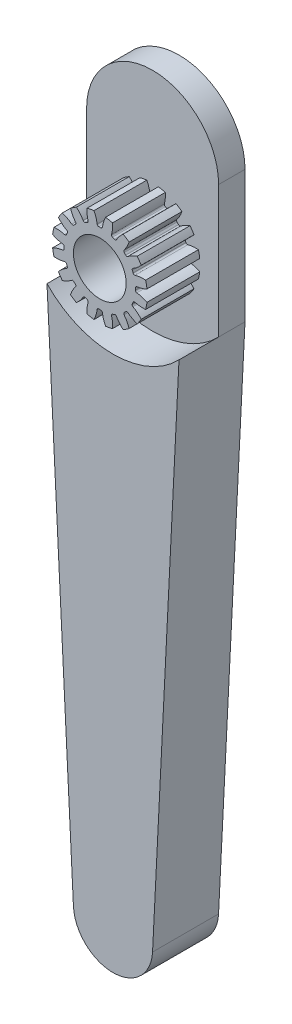
from build123d import *

# Parameters (mm, degrees)
SKETCH1_R                = 15
BOSS_EXTRUDE1_DEPTH      = 10
SKETCH2_R                = 18
BOSS_EXTRUDE2_DEPTH      = 20
CUT_EXTRUDE3_START       = -20
CUT_EXTRUDE3_DEPTH       = 20
FILLET1_R                = 0.6
CIRPATTERN1_COUNT        = 16
FILLET1_OF_CIRPATTERN1_R = 0.6
BOSS_EXTRUDE5_DEPTH      = 15
BOSS_EXTRUDE6_DEPTH      = 10
CUT_EXTRUDE4_DEPTH       = 270.867002732
CUT_EXTRUDE4_DEPTH_BACK  = 270.867002732
SKETCH10_R               = 10


with BuildPart() as part:
    # Sketch1 → Boss-Extrude1 (new body)
    with BuildSketch(Plane.XY):
        with BuildLine():
            Line((0, -50), (0, 0))
            Line((0, 0), (-50, 0))
            Line((-50, 0), (-50, -50))
            Line((-50, -50), (-39.981072052, -249.245626077))
            ThreePointArc((-39.981072052, -249.245626077), (-25.376775281, -233.497046006), (-10, -248.492313272))
            ThreePointArc((-10, -248.492313272), (-10.004732734, -248.869088553), (-10.018927948, -249.245626077))
            Line((-10.018927948, -249.245626077), (0, -50))
        make_face()
        with Locations((-25, -248.492313272)):
            Circle(SKETCH1_R)
    extrude(amount=BOSS_EXTRUDE1_DEPTH)

    # Sketch2 → Boss-Extrude2 (add)
    with BuildSketch(Plane.XY.offset(10)):
        with Locations((-25, -30)):
            Circle(SKETCH2_R)
    extrude(amount=BOSS_EXTRUDE2_DEPTH)

    # Sketch6 → Cut-Extrude3 (cut)
    with BuildSketch(Plane.XY.offset(30).offset(CUT_EXTRUDE3_START)):
        with BuildLine():
            ThreePointArc((-27.183976529, -12.132984398), (-26.344989379, -14.270839421), (-25.952519292, -16.533645371))
            ThreePointArc((-25.952519292, -16.533645371), (-25, -16.5), (-24.047480708, -16.533645371))
            ThreePointArc((-24.047480708, -16.533645371), (-23.655010621, -14.270839421), (-22.816023471, -12.132984398))
            ThreePointArc((-22.816023471, -12.132984398), (-25, -12), (-27.183976529, -12.132984398))
        make_face()
    cut_extrude3 = extrude(amount=CUT_EXTRUDE3_DEPTH, mode=Mode.SUBTRACT)

    # Fillet1
    fillet1_edges = [part.edges().sort_by_distance(p)[0] for p in [
        (-24.047480708, -16.533645371, 20),
        (-25.952519292, -16.533645371, 20),
    ]]
    fillet(fillet1_edges, radius=FILLET1_R)

    # CirPattern1: Cut-Extrude3 ×16 about axis
    cirpattern1_axis = Axis((-25, -30, 0), (0, 0, 1))
    for i in range(1, CIRPATTERN1_COUNT):
        add(cut_extrude3.rotate(cirpattern1_axis, i * 360 / CIRPATTERN1_COUNT), mode=Mode.SUBTRACT)

    # Fillet1 of CirPattern1
    fillet1_of_cirpattern1_edges = [part.edges().sort_by_distance(p)[0] for p in [
        (-29.273337733, -17.194197229, 20),
        (-31.033363889, -17.923223932, 20),
        (-33.848617826, -19.804316474, 20),
        (-35.195683526, -21.151382174, 20),
        (-37.076776068, -23.966636111, 20),
        (-37.805802771, -25.726662267, 20),
        (-38.466354629, -29.047480708, 20),
        (-38.466354629, -30.952519292, 20),
        (-37.805802771, -34.273337733, 20),
        (-37.076776068, -36.033363889, 20),
        (-35.195683526, -38.848617826, 20),
        (-33.848617826, -40.195683526, 20),
        (-31.033363889, -42.076776068, 20),
        (-29.273337733, -42.805802771, 20),
        (-25.952519292, -43.466354629, 20),
        (-24.047480708, -43.466354629, 20),
        (-20.726662267, -42.805802771, 20),
        (-18.966636111, -42.076776068, 20),
        (-16.151382174, -40.195683526, 20),
        (-14.804316474, -38.848617826, 20),
        (-12.923223932, -36.033363889, 20),
        (-12.194197229, -34.273337733, 20),
        (-11.533645371, -30.952519292, 20),
        (-11.533645371, -29.047480708, 20),
        (-12.194197229, -25.726662267, 20),
        (-12.923223932, -23.966636111, 20),
        (-14.804316474, -21.151382174, 20),
        (-16.151382174, -19.804316474, 20),
        (-18.966636111, -17.923223932, 20),
        (-20.726662267, -17.194197229, 20),
    ]]
    fillet(fillet1_of_cirpattern1_edges, radius=FILLET1_OF_CIRPATTERN1_R)

    # Sketch8 → Boss-Extrude5 (add)
    with BuildSketch(Plane.XY.offset(10)):
        with BuildLine():
            Line((-50, -50), (-39.981072052, -249.245626077))
            ThreePointArc((-39.981072052, -249.245626077), (-25, -263.492313272), (-10.018927948, -249.245626077))
            Line((-10.018927948, -249.245626077), (0, -50))
            ThreePointArc((0, -50), (-25, -60.628063721), (-50, -50))
        make_face()
    extrude(amount=BOSS_EXTRUDE5_DEPTH)

    # Sketch9 → Boss-Extrude6 (add)
    with BuildSketch(Plane(origin=(0, 0, 0), x_dir=(-1, 0, 0), z_dir=(0, 0, -1))):
        with BuildLine():
            Line((0, 0), (50, 0))
            ThreePointArc((50, 0), (25, 25), (0, 0))
        make_face()
    extrude(amount=-BOSS_EXTRUDE6_DEPTH)

    # Sketch10 → Cut-Extrude4 (cut, two sides: drawn at the far end of the back side and taken through both)
    with BuildSketch(Plane.XY.offset(30).offset(-CUT_EXTRUDE4_DEPTH_BACK)):
        with Locations((-25, -30)):
            Circle(SKETCH10_R)
    extrude(amount=CUT_EXTRUDE4_DEPTH + CUT_EXTRUDE4_DEPTH_BACK, mode=Mode.SUBTRACT)


solid = part.part
